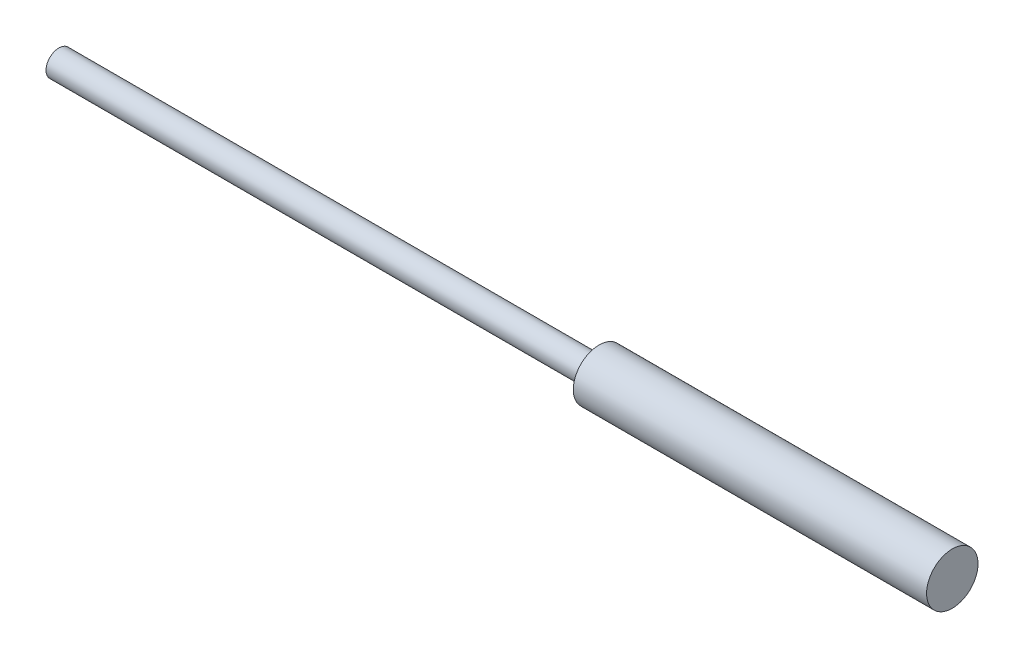
from build123d import *

# Parameters (mm, degrees)
SKETCH3_R           = 1.5
BASE_EXTRUDE_DEPTH  = 104.2
SKETCH4_R           = 3
BOSS_EXTRUDE1_DEPTH = 41.2


with BuildPart() as part:
    # Sketch3 → Base-Extrude (new body)
    with BuildSketch(Plane.ZY.offset(-2551.349581797)):
        with Locations((18.5, 11.5)):
            Circle(SKETCH3_R)
    extrude(amount=-BASE_EXTRUDE_DEPTH)

    # Sketch4 → Boss-Extrude1 (add)
    with BuildSketch(Plane.ZY.offset(-2655.549581797)):
        with Locations(Location((18.5, 11.5, 0), (0, 0, 180))):
            Circle(SKETCH4_R)
    extrude(amount=BOSS_EXTRUDE1_DEPTH)


solid = part.part
